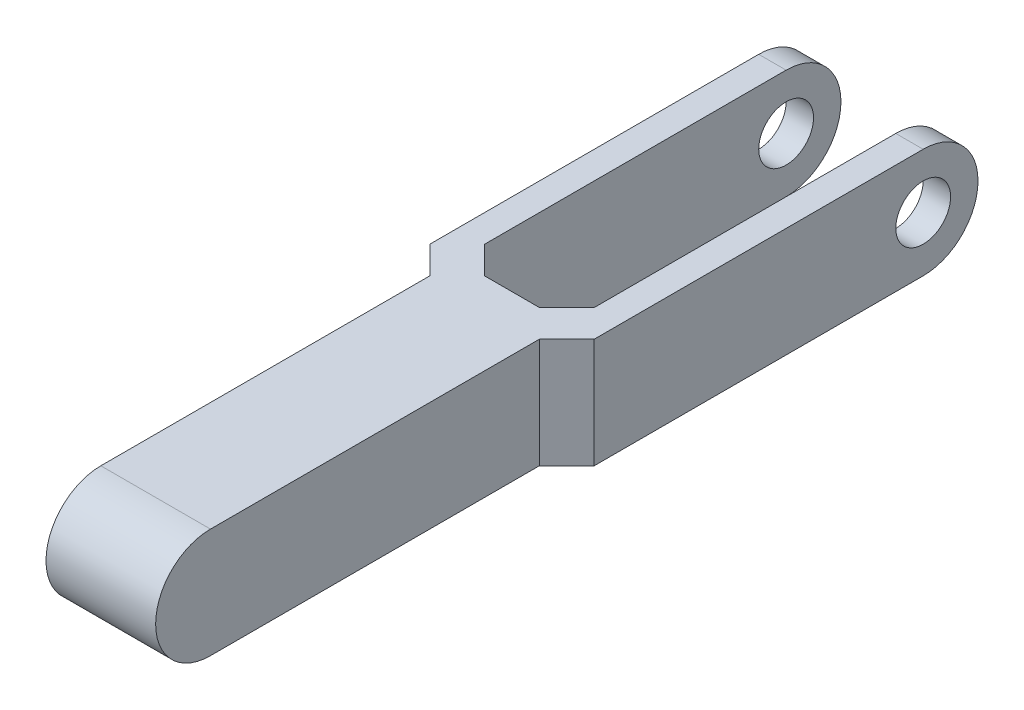
from build123d import *

# Parameters (mm, degrees)
BOSS_EXTRUDE1_DEPTH = 30
SKETCH2_W           = 40
SKETCH2_H           = 20
SKETCH2_W_2         = 10
CUT_EXTRUDE1_DEPTH  = 275.590604355


with BuildPart() as part:
    # Sketch1 → Boss-Extrude1 (new, symmetric)
    with BuildSketch(Plane(origin=(0, 0, 0), x_dir=(0, 0, -1), z_dir=(1, 0, 0))):
        with BuildLine():
            ThreePointArc((20, 0), (14.142135624, 14.142135624), (0, 20))
            Line((0, 20), (0, 10))
            ThreePointArc((0, 10), (7.071067812, 7.071067812), (10, 0))
            ThreePointArc((10, 0), (7.071067812, -7.071067812), (0, -10))
            Line((0, -10), (0, -20))
            ThreePointArc((0, -20), (14.142135624, -14.142135624), (20, 0))
        make_face()
        with BuildLine():
            Line((0, 10), (0, 20))
            ThreePointArc((0, 20), (-20, 0), (0, -20))
            Line((0, -20), (0, -10))
            ThreePointArc((0, -10), (-10, 0), (0, 10))
        make_face()
        with BuildLine():
            ThreePointArc((20, 0), (14.142135624, 14.142135624), (0, 20))
            Line((0, 20), (0, 10))
            ThreePointArc((0, 10), (7.071067812, 7.071067812), (10, 0))
            ThreePointArc((10, 0), (7.071067812, -7.071067812), (0, -10))
            Line((0, -10), (0, -20))
            ThreePointArc((0, -20), (14.142135624, -14.142135624), (20, 0))
        make_face()
        with BuildLine():
            Line((0, 10), (0, 20))
            ThreePointArc((0, 20), (-20, 0), (0, -20))
            Line((0, -20), (0, -10))
            ThreePointArc((0, -10), (-10, 0), (0, 10))
        make_face()
        with BuildLine():
            Line((250, 20), (0, 20))
            ThreePointArc((0, 20), (14.142135624, 14.142135624), (20, 0))
            ThreePointArc((20, 0), (14.142135624, -14.142135624), (0, -20))
            Line((0, -20), (250, -20))
            ThreePointArc((250, -20), (230, 0), (250, 20))
        make_face()
        with BuildLine():
            ThreePointArc((270, 0), (264.142135624, 14.142135624), (250, 20))
            Line((250, 20), (250, 10))
            ThreePointArc((250, 10), (257.071067812, 7.071067812), (260, 0))
            ThreePointArc((260, 0), (257.071067812, -7.071067812), (250, -10))
            Line((250, -10), (250, -20))
            ThreePointArc((250, -20), (264.142135624, -14.142135624), (270, 0))
        make_face()
        with BuildLine():
            Line((250, 10), (250, 20))
            ThreePointArc((250, 20), (230, 0), (250, -20))
            Line((250, -20), (250, -10))
            ThreePointArc((250, -10), (240, 0), (250, 10))
        make_face()
        with BuildLine():
            ThreePointArc((270, 0), (264.142135624, 14.142135624), (250, 20))
            Line((250, 20), (250, 10))
            ThreePointArc((250, 10), (257.071067812, 7.071067812), (260, 0))
            ThreePointArc((260, 0), (257.071067812, -7.071067812), (250, -10))
            Line((250, -10), (250, -20))
            ThreePointArc((250, -20), (264.142135624, -14.142135624), (270, 0))
        make_face()
        with BuildLine():
            Line((250, 10), (250, 20))
            ThreePointArc((250, 20), (230, 0), (250, -20))
            Line((250, -20), (250, -10))
            ThreePointArc((250, -10), (240, 0), (250, 10))
        make_face()
        with BuildLine():
            ThreePointArc((10, 0), (7.071067812, 7.071067812), (0, 10))
            Line((0, 10), (0, -10))
            ThreePointArc((0, -10), (7.071067812, -7.071067812), (10, 0))
        make_face()
        with BuildLine():
            Line((0, -10), (0, 10))
            ThreePointArc((0, 10), (-10, 0), (0, -10))
        make_face()
        with BuildLine():
            ThreePointArc((10, 0), (7.071067812, 7.071067812), (0, 10))
            Line((0, 10), (0, -10))
            ThreePointArc((0, -10), (7.071067812, -7.071067812), (10, 0))
        make_face()
        with BuildLine():
            Line((0, -10), (0, 10))
            ThreePointArc((0, 10), (-10, 0), (0, -10))
        make_face()
    extrude(amount=BOSS_EXTRUDE1_DEPTH, both=True)

    # Sketch2 → Cut-Extrude1 (cut, through all)
    with BuildSketch(Plane(origin=(0, 20, 0), x_dir=(1, 0, 0), z_dir=(0, 1, 0))):
        with Locations((0, 260)):
            Rectangle(SKETCH2_W, SKETCH2_H)
        Polygon((20, 250), (-20, 250), (-20, 140), (-10, 130), (10, 130), (20, 140), align=None)
        Polygon((-20, 120), (-30, 130), (-30, 0), (-20, 0), align=None)
        Polygon((30, 130), (20, 120), (20, 0), (30, 0), align=None)
        with Locations((-25, -10)):
            Rectangle(SKETCH2_W_2, SKETCH2_H)
        with Locations((25, -10)):
            Rectangle(SKETCH2_W_2, SKETCH2_H)
    extrude(amount=-CUT_EXTRUDE1_DEPTH, mode=Mode.SUBTRACT)


solid = part.part
